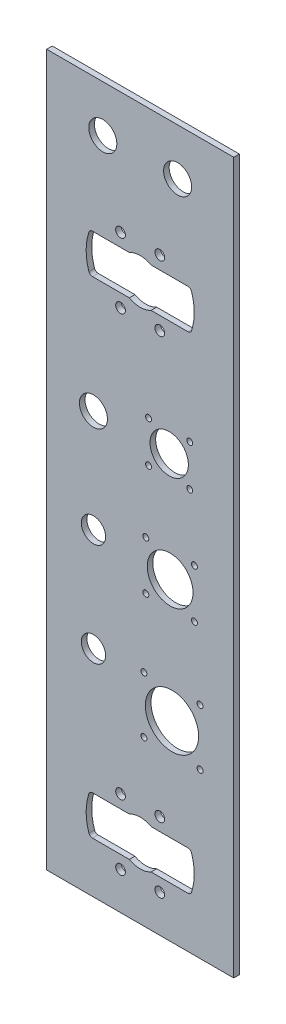
from build123d import *

# Parameters (mm, degrees)
SKETCH1_W           = 100
SKETCH1_H           = 380
BOSS_EXTRUDE1_DEPTH = 3
SKETCH1_3_R         = 6.5
SKETCH1_3_R_2       = 7.5
SKETCH1_3_R_3       = 2.6
SKETCH1_3_R_4       = 1.6
SKETCH1_3_R_5       = 14.25
SKETCH1_3_R_6       = 12.25
SKETCH1_3_R_7       = 10.25
CUT_EXTRUDE1_DEPTH  = 3


with BuildPart() as part:
    # Sketch1 → Boss-Extrude1 (new body)
    with BuildSketch(Plane.XY):
        with Locations((50, 190)):
            Rectangle(SKETCH1_W, SKETCH1_H)
    extrude(amount=-BOSS_EXTRUDE1_DEPTH)

    # Sketch1<3> → Cut-Extrude1 (cut)
    with BuildSketch(Plane.XY):
        with Locations((25, 170)):
            Circle(SKETCH1_3_R)
        with Locations((25, 115)):
            Circle(SKETCH1_3_R)
        with Locations((25, 225)):
            Circle(SKETCH1_3_R_2)
        with Locations((70, 355)):
            Circle(SKETCH1_3_R_2)
        with Locations((30, 355)):
            Circle(SKETCH1_3_R_2)
        with Locations((39.5, 20)):
            Circle(SKETCH1_3_R_3)
        with Locations((60.5, 20)):
            Circle(SKETCH1_3_R_3)
        with Locations((39.5, 55)):
            Circle(SKETCH1_3_R_3)
        with Locations((60.5, 55)):
            Circle(SKETCH1_3_R_3)
        with Locations((39.5, 280)):
            Circle(SKETCH1_3_R_3)
        with Locations((60.5, 280)):
            Circle(SKETCH1_3_R_3)
        with Locations((39.5, 315)):
            Circle(SKETCH1_3_R_3)
        with Locations((60.5, 315)):
            Circle(SKETCH1_3_R_3)
        with Locations((52, 117.5)):
            Circle(SKETCH1_3_R_4)
        with Locations((82, 117.5)):
            Circle(SKETCH1_3_R_4)
        with Locations((52, 87.5)):
            Circle(SKETCH1_3_R_4)
        with Locations((82, 87.5)):
            Circle(SKETCH1_3_R_4)
        with Locations((67, 102.5)):
            Circle(SKETCH1_3_R_5)
        with Locations((66, 167.5)):
            Circle(SKETCH1_3_R_6)
        with Locations((53, 180.5)):
            Circle(SKETCH1_3_R_4)
        with Locations((79, 180.5)):
            Circle(SKETCH1_3_R_4)
        with Locations((79, 154.5)):
            Circle(SKETCH1_3_R_4)
        with Locations((53, 154.5)):
            Circle(SKETCH1_3_R_4)
        with Locations((65.5, 225.5)):
            Circle(SKETCH1_3_R_7)
        with Locations((54.5, 236.5)):
            Circle(SKETCH1_3_R_4)
        with Locations((76.5, 236.5)):
            Circle(SKETCH1_3_R_4)
        with Locations((54.5, 214.5)):
            Circle(SKETCH1_3_R_4)
        with Locations((76.5, 214.5)):
            Circle(SKETCH1_3_R_4)
        with BuildLine():
            Line((44.190524981, 48), (24.478244574, 48))
            ThreePointArc((24.478244574, 48), (23.30861654, 47.622334818), (22.58071629, 46.63197026))
            ThreePointArc((22.58071629, 46.63197026), (21.1, 37.5), (22.58071629, 28.36802974))
            ThreePointArc((22.58071629, 28.36802974), (23.30861654, 27.377665182), (24.478244574, 27))
            Line((24.478244574, 27), (44.190524981, 27))
            ThreePointArc((44.190524981, 27), (50, 25.5), (55.809475019, 27))
            Line((55.809475019, 27), (75.521755425, 27))
            ThreePointArc((75.521755425, 27), (76.69138346, 27.377665182), (77.41928371, 28.36802974))
            ThreePointArc((77.41928371, 28.36802974), (78.9, 37.5), (77.41928371, 46.63197026))
            ThreePointArc((77.41928371, 46.63197026), (76.69138346, 47.622334818), (75.521755426, 48))
            Line((75.521755426, 48), (55.809475019, 48))
            ThreePointArc((55.809475019, 48), (50, 49.5), (44.190524981, 48))
        make_face()
        with BuildLine():
            Line((44.190524981, 308), (24.478244574, 308))
            ThreePointArc((24.478244574, 308), (23.30861654, 307.622334818), (22.58071629, 306.63197026))
            ThreePointArc((22.58071629, 306.63197026), (21.1, 297.5), (22.58071629, 288.36802974))
            ThreePointArc((22.58071629, 288.36802974), (23.30861654, 287.377665182), (24.478244574, 287))
            Line((24.478244574, 287), (44.190524981, 287))
            ThreePointArc((44.190524981, 287), (50, 285.5), (55.809475019, 287))
            Line((55.809475019, 287), (75.521755426, 287))
            ThreePointArc((75.521755426, 287), (76.69138346, 287.377665182), (77.41928371, 288.36802974))
            ThreePointArc((77.41928371, 288.36802974), (78.9, 297.5), (77.41928371, 306.63197026))
            ThreePointArc((77.41928371, 306.63197026), (76.69138346, 307.622334818), (75.521755426, 308))
            Line((75.521755426, 308), (55.809475019, 308))
            ThreePointArc((55.809475019, 308), (50, 309.5), (44.190524981, 308))
        make_face()
    extrude(amount=-CUT_EXTRUDE1_DEPTH, mode=Mode.SUBTRACT)


solid = part.part
